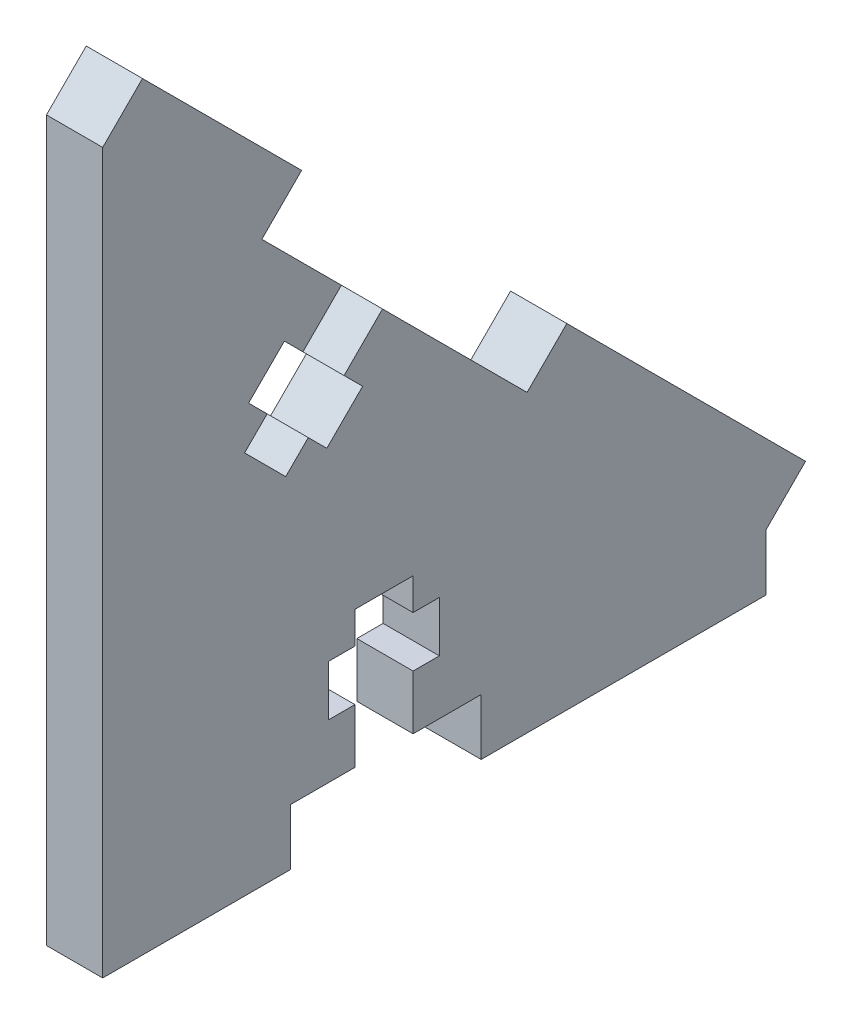
from build123d import *

# Parameters (mm, degrees)
BOSS_EXTRUDE1_DEPTH = 3
SKETCH4_W           = 3
SKETCH4_H           = 10
SKETCH4_H_2         = 15.175339059
BOSS_EXTRUDE3_DEPTH = 3
CUT_EXTRUDE1_DEPTH  = 10
SKETCH6_W           = 3
SKETCH6_H           = 12
SKETCH6_H_2         = 18
BOSS_EXTRUDE4_DEPTH = 3
CUT_EXTRUDE2_DEPTH  = 3


with BuildPart() as part:
    # Sketch2 → Boss-Extrude1 (new body)
    with BuildSketch(Plane(origin=(0, 0, 0), x_dir=(0, 0, -1), z_dir=(1, 0, 0))):
        Polygon((0, 0), (0, 35.355339059), (35.355339059, 0), align=None)
    extrude(amount=BOSS_EXTRUDE1_DEPTH)

    # Sketch4 → Boss-Extrude3 (add)
    with BuildSketch(Plane.XZ):
        with Locations((1.5, -5)):
            Rectangle(SKETCH4_W, SKETCH4_H)
        with Locations((1.5, -27.76766953)):
            Rectangle(SKETCH4_W, SKETCH4_H_2)
    extrude(amount=BOSS_EXTRUDE3_DEPTH)

    # Sketch5 → Cut-Extrude1 (cut)
    with BuildSketch(Plane(origin=(3, 0, 0), x_dir=(0, 0, -1), z_dir=(1, 0, 0))):
        Polygon((13.45, 0), (13.45, 2.9), (12.05, 2.9), (12.05, 5.6), (13.45, 5.6), (13.45, 7.3), (16.55, 7.3), (16.55, 5.6), (17.95, 5.6), (17.95, 2.9), (16.55, 2.9), (16.55, 0), align=None)
    extrude(amount=-CUT_EXTRUDE1_DEPTH, mode=Mode.SUBTRACT)

    # Sketch6 → Boss-Extrude4 (add)
    with BuildSketch(Plane(origin=(0, 17.67766953, -17.67766953), x_dir=(1, 0, 0), z_dir=(0, 0.7071067811865515, -0.7071067811865437))):
        with Locations((1.5, -19)):
            Rectangle(SKETCH6_W, SKETCH6_H)
        with Locations((1.5, 16)):
            Rectangle(SKETCH6_W, SKETCH6_H_2)
    extrude(amount=BOSS_EXTRUDE4_DEPTH)

    # Sketch7 → Cut-Extrude2 (cut)
    with BuildSketch(Plane(origin=(3, 0, 0), x_dir=(0, 0, -1), z_dir=(1, 0, 0))):
        Polygon((14.919953083, 20.435385976), (12.869343418, 18.384776311), (13.859292911, 17.394826817), (11.950104602, 15.485638508), (10.960155108, 16.475588002), (9.75807358, 15.273506474), (7.566042559, 17.465537495), (8.768124087, 18.667619023), (7.778174593, 19.657568517), (9.687362902, 21.566756826), (10.677312396, 20.576807333), (12.727922061, 22.627416998), align=None)
    extrude(amount=-CUT_EXTRUDE2_DEPTH, mode=Mode.SUBTRACT)


solid = part.part
